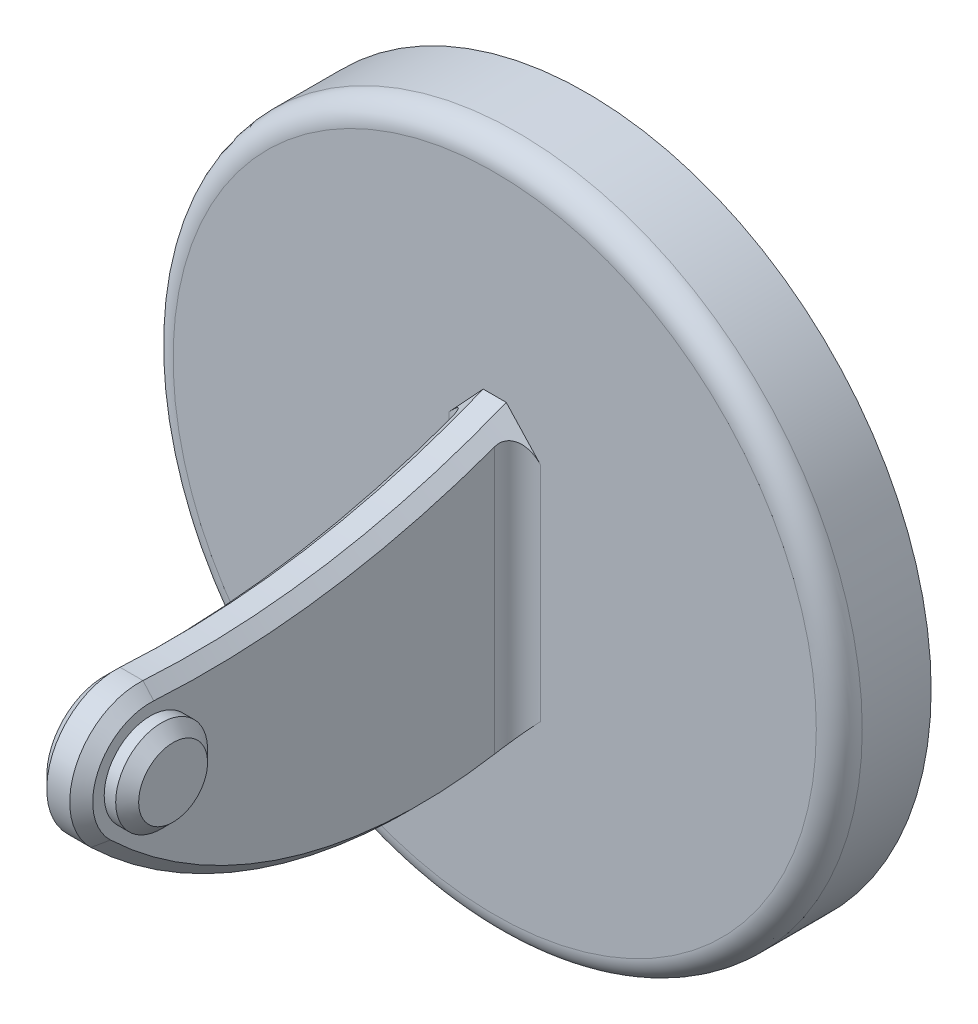
from build123d import *

# Parameters (mm, degrees)
SKETCH1_R           = 75
BOSS_EXTRUDE1_DEPTH = 20
FILLET1_R           = 5
BOSS_EXTRUDE2_DEPTH = 5
CHAMFER1_SIZE       = 2.5
FILLET2_R           = 5
SKETCH3_R           = 10
BOSS_EXTRUDE4_DEPTH = 5
CHAMFER3_SIZE       = 2.5
SKETCH4_R           = 5
CUT_EXTRUDE1_DEPTH  = 10


with BuildPart() as part:
    # Sketch1 → Boss-Extrude1 (new body)
    with BuildSketch(Plane(origin=(0, 0, 0), x_dir=(0, 1, 0), z_dir=(0, 0, 1))):
        with Locations(Location((0, 0, 0), (0, 0, 270))):
            Circle(SKETCH1_R)
    extrude(amount=BOSS_EXTRUDE1_DEPTH)

    # Fillet1
    fillet1_edges = [part.edges().sort_by_distance(p)[0] for p in [
        (-75, 0, 20),
    ]]
    fillet(fillet1_edges, radius=FILLET1_R)

    # Sketch2 → Boss-Extrude2 (add, symmetric)
    with BuildSketch(Plane.YZ):
        with BuildLine():
            Line((-35, 15), (30, 15))
            ThreePointArc((30, 15), (17.428098582, 56.126843631), (14.970645506, 99.06203778))
            ThreePointArc((14.970645506, 99.06203778), (6.012327577, 113.742340307), (-10.849201429, 110.358321696))
            ThreePointArc((-10.849201429, 110.358321696), (-35.460543036, 65.854059614), (-35, 15))
        make_face()
    extrude(amount=BOSS_EXTRUDE2_DEPTH, both=True)

    # Chamfer1
    chamfer1_edges = [part.edges().sort_by_distance(p)[0] for p in [
        (5, 16.970295051, 58.803839559),
        (-5, 6.012327577, 113.742340307),
        (-5, -34.796467261, 68.341174934),
        (5, -34.796467261, 68.341174934),
        (5, 6.012327577, 113.742340307),
        (-5, 16.970295051, 58.803839559),
    ]]
    chamfer(chamfer1_edges, length=CHAMFER1_SIZE)

    # Fillet2
    fillet2_edges = [part.edges().sort_by_distance(p)[0] for p in [
        (-5, -4.241511046, 20),
        (5, -4.241511046, 20),
    ]]
    fillet(fillet2_edges, radius=FILLET2_R)

    # Sketch3 → Boss-Extrude4 (add)
    with BuildSketch(Plane.YZ.offset(5)):
        with Locations(Location((0, 100, 0), (0, 0, 270))):
            Circle(SKETCH3_R)
    extrude(amount=BOSS_EXTRUDE4_DEPTH)

    # Chamfer3
    chamfer3_edges = [part.edges().sort_by_distance(p)[0] for p in [
        (10, 0, 110),
    ]]
    chamfer(chamfer3_edges, length=CHAMFER3_SIZE)

    # Sketch4 → Cut-Extrude1 (cut)
    with BuildSketch(Plane(origin=(-5, 0, 0), x_dir=(0, -1, 0), z_dir=(-1, 0, 0))):
        with Locations(Location((0, 100, 0), (0, 0, 90))):
            Circle(SKETCH4_R)
    extrude(amount=-CUT_EXTRUDE1_DEPTH, mode=Mode.SUBTRACT)


solid = part.part
